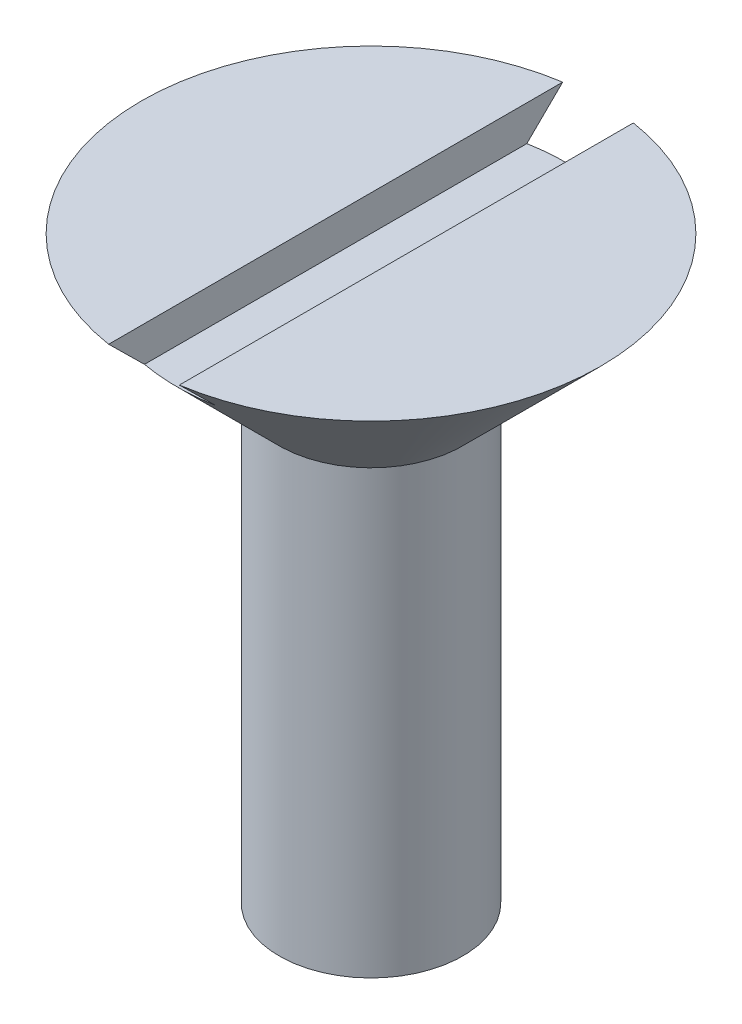
from build123d import *

# Parameters (mm, degrees)
SKETCH2_W          = 2
SKETCH2_H          = 2
CUT_EXTRUDE1_DEPTH = 10


with BuildPart() as part:
    # Sketch1 → Revolve1 (revolve)
    with BuildSketch(Plane.XY, mode=Mode.PRIVATE) as revolve1_sk:
        Polygon((0, 49.555627393), (6.5, 49.555627393), (2.596444265, 45.652071659), (2.596444265, 33.152071659), (0, 31.653013863), align=None)
    revolve(revolve1_sk.sketch.rotate(Axis((0, 49.555627393, 0), (0, -1, 0)), 180), axis=Axis((0, 49.555627393, 0), (0, -1, 0)))

    # Sketch2 → Cut-Extrude1 (cut, symmetric)
    with BuildSketch(Plane.XY):
        with Locations((0, 49.555627393)):
            Rectangle(SKETCH2_W, SKETCH2_H)
    extrude(amount=CUT_EXTRUDE1_DEPTH, both=True, mode=Mode.SUBTRACT)


solid = part.part
